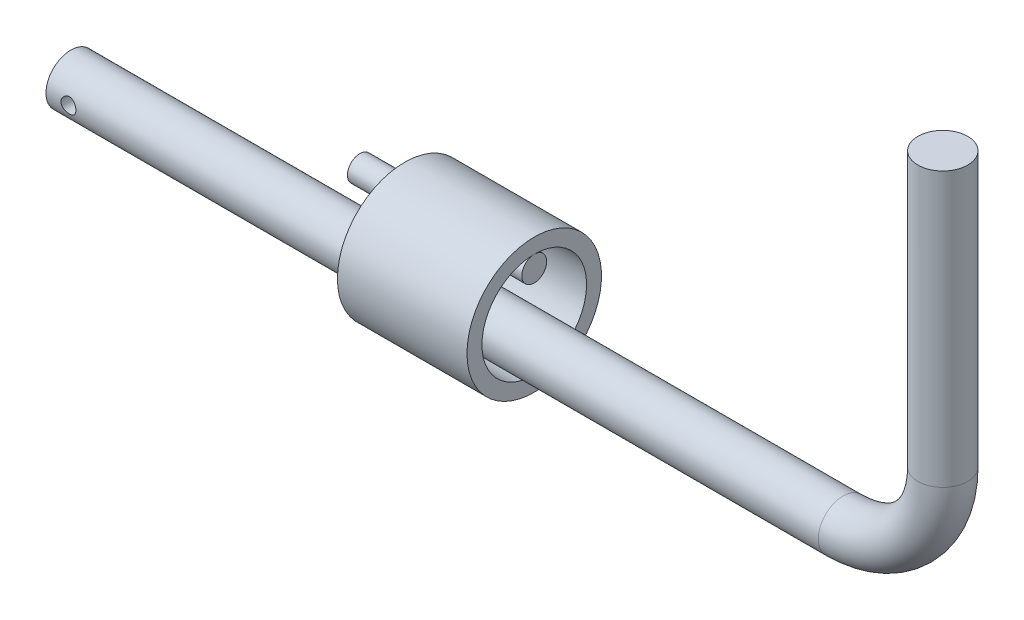
from build123d import *

# Parameters (mm, degrees)
SKETCH_2_R               = 5
CUT_EXTRUDE_1_DEPTH      = 196.064092126
CUT_EXTRUDE_1_DEPTH_BACK = 196.064092126
SKETCH_3_R               = 1.5
SKETCH_4_R               = 13.5
SKETCH_4_R_2             = 10.5
EXTRUDE_1_DEPTH          = 26
SKETCH_5_R               = 2.5
EXTRUDE_2_DEPTH          = 35


with BuildPart() as part:
    # По траектории1: sweep along a path in Эскиз1
    with BuildLine(Plane.XY) as sweep_1_path:
        Line((0, 0), (155, 0))
        ThreePointArc((155, 0), (169.142135624, 5.857864376), (175, 20))
        Line((175, 20), (175, 75))
    # Эскиз2 → По траектории1 (sweep)
    with BuildSketch(Plane(origin=(0, 0, 0), x_dir=(0, 0, -1), z_dir=(1, 0, 0))):
        Circle(SKETCH_2_R)
    sweep(path=sweep_1_path.line)

    # Эскиз3 → Вырез-Вытянуть1 (cut, two sides: drawn at the far end of the back side and taken through both)
    with BuildSketch(Plane.XY.offset(-CUT_EXTRUDE_1_DEPTH_BACK)):
        with Locations((4.5, 0)):
            Circle(SKETCH_3_R)
    extrude(amount=CUT_EXTRUDE_1_DEPTH + CUT_EXTRUDE_1_DEPTH_BACK, mode=Mode.SUBTRACT)


with BuildPart() as body_2:
    # Эскиз4 → Бобышка-Вытянуть1 (new body)
    with BuildSketch(Plane.ZY.offset(-67)):
        with Locations((0, 5.5)):
            Circle(SKETCH_4_R)
        with Locations((0, 5.5)):
            Circle(SKETCH_4_R_2, mode=Mode.SUBTRACT)
    extrude(amount=-EXTRUDE_1_DEPTH)


with BuildPart() as body_3:
    # Эскиз5 → Бобышка-Вытянуть2 (new body)
    with BuildSketch(Plane(origin=(93, 0, 0), x_dir=(0, 0, -1), z_dir=(1, 0, 0))):
        with Locations((0, 13.5)):
            Circle(SKETCH_5_R)
    extrude(amount=-EXTRUDE_2_DEPTH)


solid = Compound([part.part, body_2.part, body_3.part])
